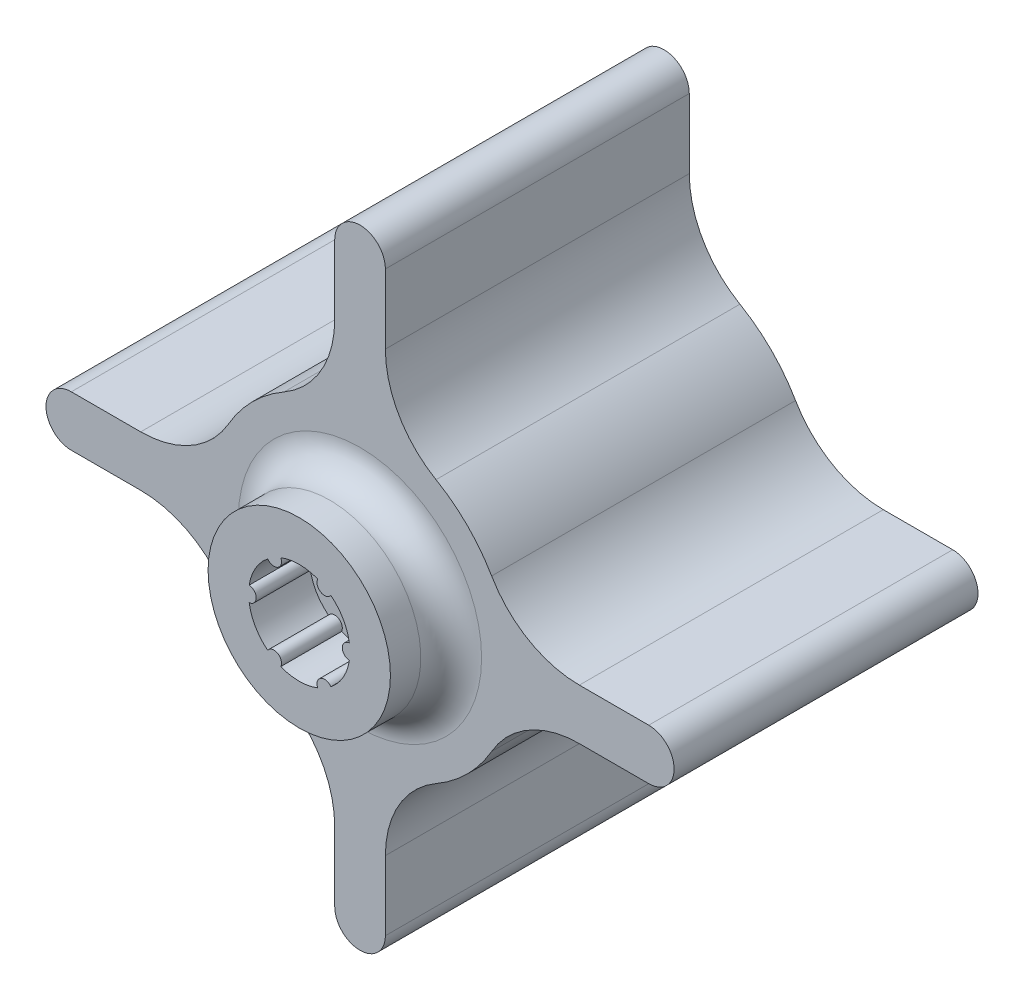
from build123d import *

# Parameters (mm, degrees)
CROQUIS2_R              = 4.5
SALIENTE_EXTRUIR1_DEPTH = 3
CROQUIS3_R              = 1.25
SALIENTE_EXTRUIR2_DEPTH = 15
REDONDEO1_R             = 1.5


with BuildPart() as part:
    # Croquis2 → Saliente-Extruir1 (new body)
    with BuildSketch(Plane.XY):
        Circle(CROQUIS2_R)
        with BuildLine():
            ThreePointArc((2.471875, 0.373943825), (2.165063509, 1.25), (1.559782352, 1.953734632))
            ThreePointArc((1.559782352, 1.953734632), (1.0625, 1.840303983), (0.912092648, 2.327678458))
            ThreePointArc((0.912092648, 2.327678458), (0, 2.5), (-0.912092648, 2.327678458))
            ThreePointArc((-0.912092648, 2.327678458), (-1.0625, 1.840303983), (-1.559782352, 1.953734632))
            ThreePointArc((-1.559782352, 1.953734632), (-2.165063509, 1.25), (-2.471875, 0.373943825))
            ThreePointArc((-2.471875, 0.373943825), (-2.125, 0), (-2.471875, -0.373943825))
            ThreePointArc((-2.471875, -0.373943825), (-2.165063509, -1.25), (-1.559782352, -1.953734632))
            ThreePointArc((-1.559782352, -1.953734632), (-1.0625, -1.840303983), (-0.912092648, -2.327678458))
            ThreePointArc((-0.912092648, -2.327678458), (0, -2.5), (0.912092648, -2.327678458))
            ThreePointArc((0.912092648, -2.327678458), (1.0625, -1.840303983), (1.559782352, -1.953734632))
            ThreePointArc((1.559782352, -1.953734632), (2.165063509, -1.25), (2.471875, -0.373943825))
            ThreePointArc((2.471875, -0.373943825), (2.125, 0), (2.471875, 0.373943825))
        make_face(mode=Mode.SUBTRACT)
    extrude(amount=SALIENTE_EXTRUIR1_DEPTH)

    # Croquis3 → Saliente-Extruir2 (add)
    with BuildSketch(Plane(origin=(0, 0, 0), x_dir=(-1, 0, 0), z_dir=(0, 0, -1))):
        with BuildLine():
            Line((1.25, 10.825317547), (1.25, 14.25))
            ThreePointArc((1.25, 14.25), (0, 15.5), (-1.25, 14.25))
            Line((-1.25, 14.25), (-1.25, 10.825317547))
            ThreePointArc((-1.25, 10.825317547), (-1.919872981, 8.325317547), (-3.75, 6.495190528))
            ThreePointArc((-3.75, 6.495190528), (-5.303300859, 5.303300859), (-6.495190528, 3.75))
            ThreePointArc((-6.495190528, 3.75), (-8.325317547, 1.919872981), (-10.825317547, 1.25))
            Line((-10.825317547, 1.25), (-14.25, 1.25))
            ThreePointArc((-14.25, 1.25), (-15.5, 0), (-14.25, -1.25))
            Line((-14.25, -1.25), (-10.825317547, -1.25))
            ThreePointArc((-10.825317547, -1.25), (-8.325317547, -1.919872981), (-6.495190528, -3.75))
            ThreePointArc((-6.495190528, -3.75), (-5.303300859, -5.303300859), (-3.75, -6.495190528))
            ThreePointArc((-3.75, -6.495190528), (-1.919872981, -8.325317547), (-1.25, -10.825317547))
            Line((-1.25, -10.825317547), (-1.25, -14.25))
            ThreePointArc((-1.25, -14.25), (0, -15.5), (1.25, -14.25))
            Line((1.25, -14.25), (1.25, -10.825317547))
            ThreePointArc((1.25, -10.825317547), (1.919872981, -8.325317547), (3.75, -6.495190528))
            ThreePointArc((3.75, -6.495190528), (5.303300859, -5.303300859), (6.495190528, -3.75))
            ThreePointArc((6.495190528, -3.75), (8.325317547, -1.919872981), (10.825317547, -1.25))
            Line((10.825317547, -1.25), (14.25, -1.25))
            ThreePointArc((14.25, -1.25), (15.5, 0), (14.25, 1.25))
            Line((14.25, 1.25), (10.825317547, 1.25))
            ThreePointArc((10.825317547, 1.25), (8.325317547, 1.919872981), (6.495190528, 3.75))
            ThreePointArc((6.495190528, 3.75), (5.303300859, 5.303300859), (3.75, 6.495190528))
            ThreePointArc((3.75, 6.495190528), (1.919872981, 8.325317547), (1.25, 10.825317547))
        make_face()
        Circle(CROQUIS3_R, mode=Mode.SUBTRACT)
    extrude(amount=SALIENTE_EXTRUIR2_DEPTH)

    # Redondeo1
    redondeo1_edges = [part.edges().sort_by_distance(p)[0] for p in [
        (-4.5, 0, 0),
    ]]
    fillet(redondeo1_edges, radius=REDONDEO1_R)


solid = part.part
